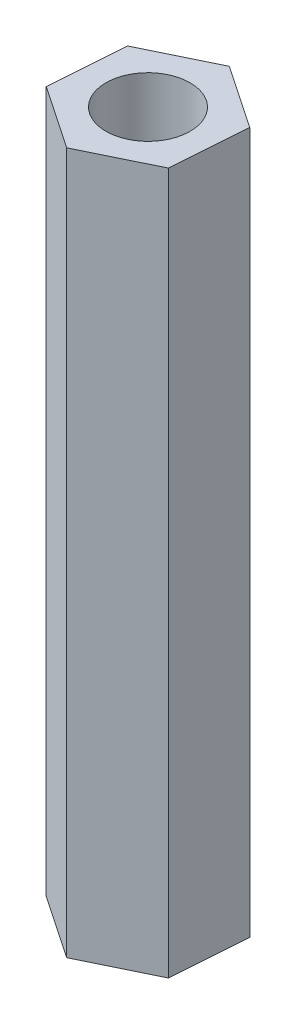
from build123d import *

# Parameters (mm, degrees)
EXTRUDE_1_DEPTH     = 25
SKETCH_2_R          = 1.5
CUT_EXTRUDE_1_DEPTH = 26.26424494


with BuildPart() as part:
    # 草图1 → 凸台-拉伸1 (new body)
    with BuildSketch(Plane(origin=(0, 0, 0), x_dir=(1, 0, 0), z_dir=(0, 1, 0))):
        Polygon((2.440476282, 1.186342637), (0.19283528, 2.706685776), (-2.247641002, 1.520343139), (-2.440476282, -1.186342637), (-0.19283528, -2.706685776), (2.247641002, -1.520343139), align=None)
    extrude(amount=EXTRUDE_1_DEPTH)

    # 草图2 → 切除-拉伸1 (cut, through all)
    with BuildSketch(Plane.XZ):
        with Locations(Location((0, 0, 0), (0, 0, 270))):
            Circle(SKETCH_2_R)
    extrude(amount=-CUT_EXTRUDE_1_DEPTH, mode=Mode.SUBTRACT)


solid = part.part
